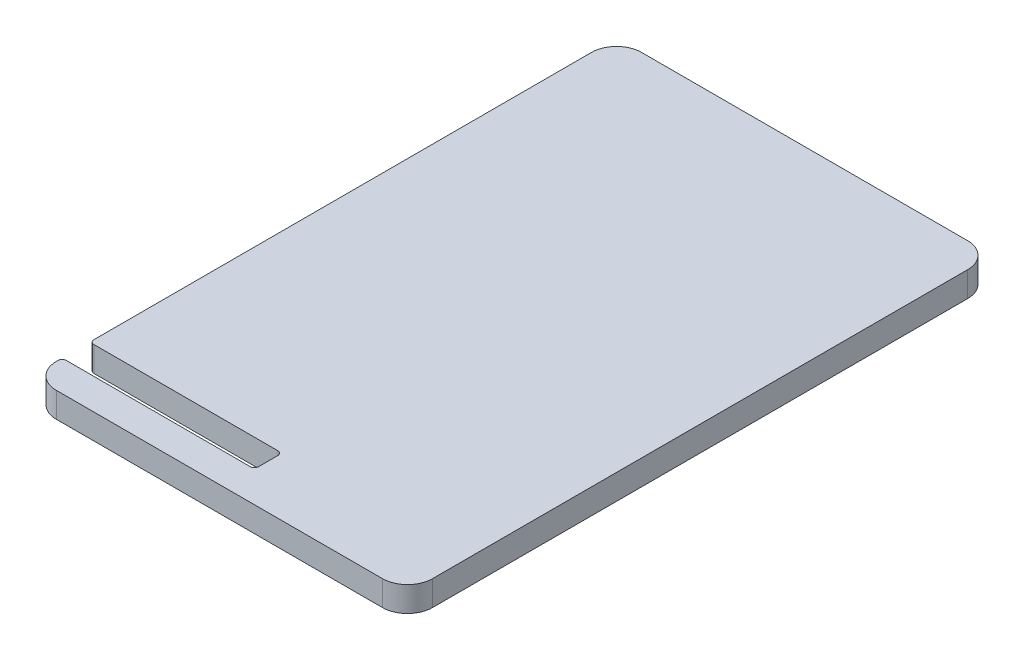
from build123d import *

# Parameters (mm, degrees)
CROQUIS1_W              = 45
CROQUIS1_H              = 70
SALIENTE_EXTRUIR1_DEPTH = 3
CROQUIS2_W              = 23
CROQUIS2_H              = 3.3
CORTAR_EXTRUIR1_DEPTH   = 3
REDONDEO1_R             = 3
REDONDEO2_R             = 0.5


with BuildPart() as part:
    # Croquis1 → Saliente-Extruir1 (new body)
    with BuildSketch(Plane(origin=(0, 0, 0), x_dir=(1, 0, 0), z_dir=(0, 1, 0))):
        with Locations((0, 0.306231574)):
            Rectangle(CROQUIS1_W, CROQUIS1_H)
    extrude(amount=SALIENTE_EXTRUIR1_DEPTH)

    # Croquis2 → Cortar-Extruir1 (cut)
    with BuildSketch(Plane(origin=(0, 3, 0), x_dir=(1, 0, 0), z_dir=(0, 1, 0))):
        with Locations((-11, -29.35)):
            Rectangle(CROQUIS2_W, CROQUIS2_H)
    extrude(amount=-CORTAR_EXTRUIR1_DEPTH, mode=Mode.SUBTRACT)

    # Redondeo1
    redondeo1_edges = [part.edges().sort_by_distance(p)[0] for p in [
        (-22.5, 1.5, -35.306231574),
        (22.5, 1.5, -35.306231574),
        (22.5, 1.5, 34.693768426),
        (-22.5, 1.5, 34.693768426),
    ]]
    fillet(redondeo1_edges, radius=REDONDEO1_R)

    # Redondeo2
    redondeo2_edges = [part.edges().sort_by_distance(p)[0] for p in [
        (-22.5, 1.5, 31),
        (-22.5, 1.5, 27.7),
        (0.5, 1.5, 27.7),
        (0.5, 1.5, 31),
    ]]
    fillet(redondeo2_edges, radius=REDONDEO2_R)


solid = part.part
